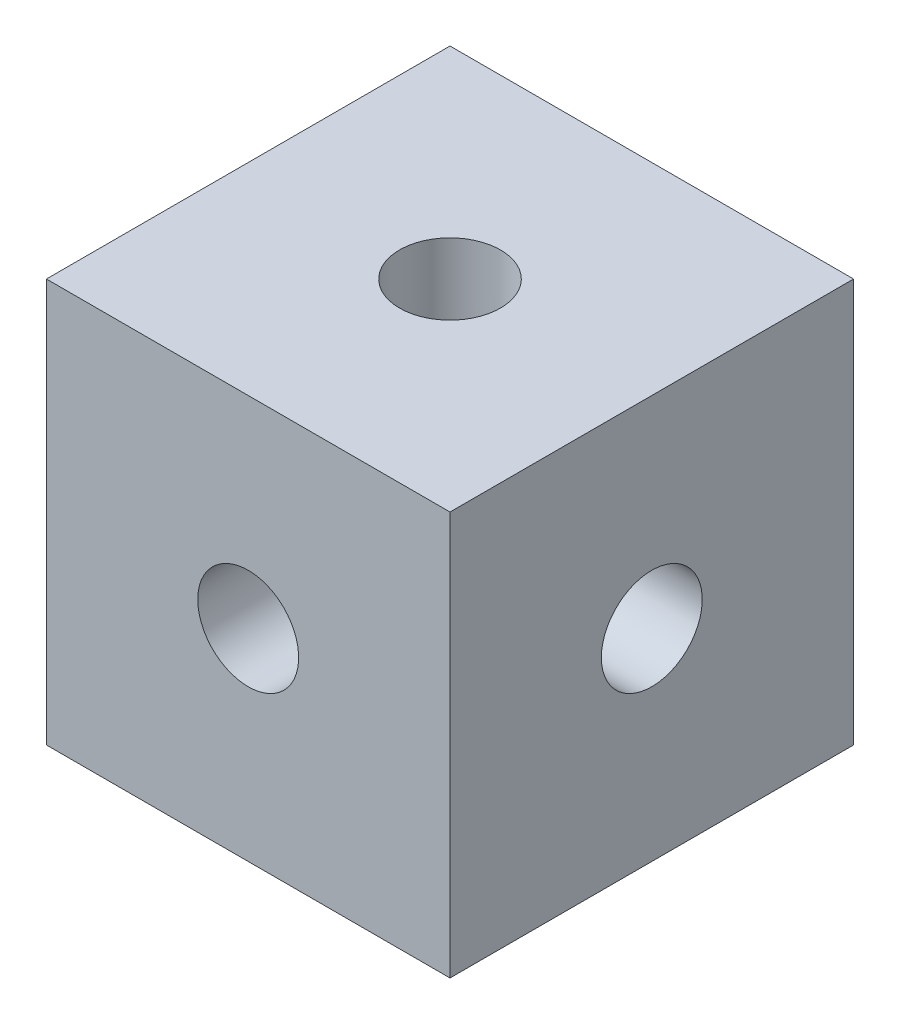
from build123d import *

# Parameters (mm, degrees)
SKETCH1_W                   = 25.4
SKETCH1_H                   = 25.4
BOSS_EXTRUDE1_DEPTH         = 25.4
F_1_4_0_25_DIAMETER_HOLE1_D = 6.35
F_1_4_0_25_DIAMETER_HOLE2_D = 6.35
F_1_4_0_25_DIAMETER_HOLE3_D = 6.35


with BuildPart() as part:
    # Sketch1 → Boss-Extrude1 (new body)
    with BuildSketch(Plane.XY):
        Rectangle(SKETCH1_W, SKETCH1_H)
    extrude(amount=BOSS_EXTRUDE1_DEPTH)

    # 1/4 (0.25) Diameter Hole1 (through all)
    with Locations(Plane(origin=(0, 0, 0), x_dir=(-1, 0, 0), z_dir=(0, 0, -1))):
        with Locations((0, 0)):
            Hole(F_1_4_0_25_DIAMETER_HOLE1_D / 2)

    # 1/4 (0.25) Diameter Hole2 (through all)
    with Locations(Plane(origin=(0, 12.7, 0), x_dir=(1, 0, 0), z_dir=(0, 1, 0))):
        with Locations((0, -12.7)):
            Hole(F_1_4_0_25_DIAMETER_HOLE2_D / 2)

    # 1/4 (0.25) Diameter Hole3 (through all)
    with Locations(Plane.ZY.offset(12.7)):
        with Locations((12.7, 0)):
            Hole(F_1_4_0_25_DIAMETER_HOLE3_D / 2)


solid = part.part
